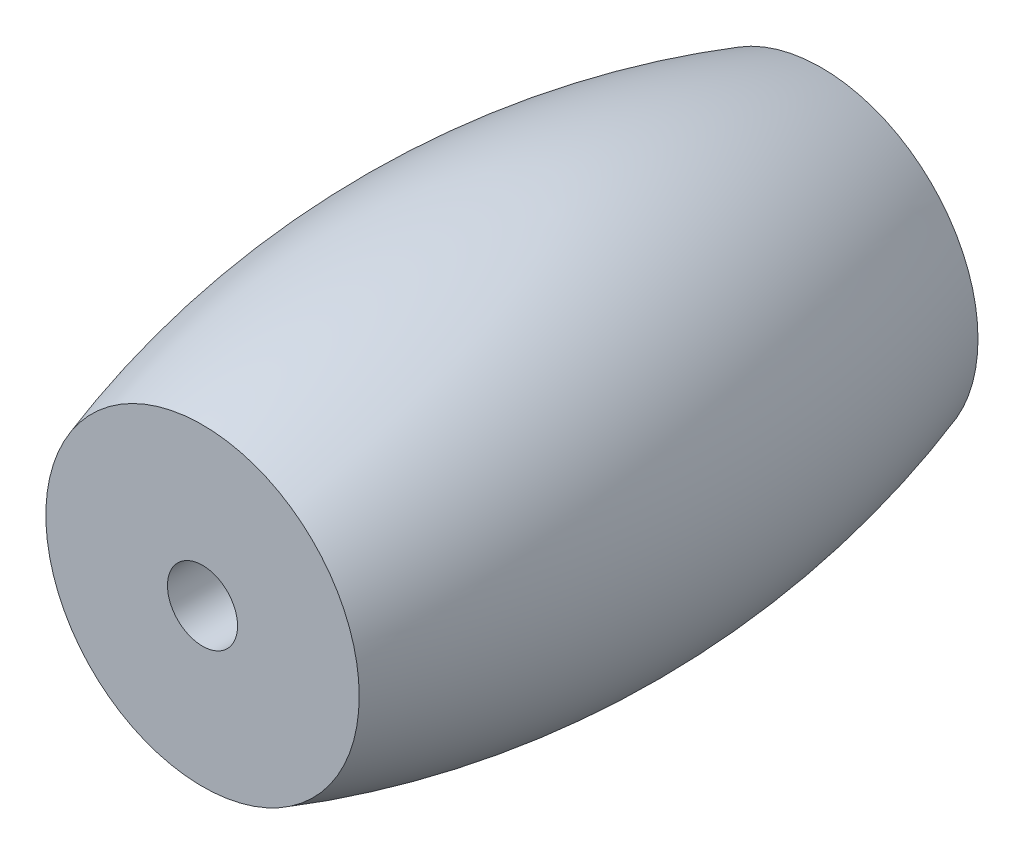
from build123d import *


with BuildPart() as part:
    # Skizze1 → Rotation3 (revolve)
    with BuildSketch(Plane(origin=(0, 0, 0), x_dir=(0, 0, -1), z_dir=(1, 0, 0)), mode=Mode.PRIVATE) as rotation3_sk:
        with BuildLine():
            ThreePointArc((15, 7.596052461), (0, 10), (-15, 7.596052461))
            Line((-15, 7.596052461), (-15, 1.7))
            Line((-15, 1.7), (15, 1.7))
            Line((15, 1.7), (15, 7.596052461))
        make_face()
    revolve(rotation3_sk.sketch.rotate(Axis((0, 0, 31.772981832), (0, 0, -1)), 90), axis=Axis((0, 0, 31.772981832), (0, 0, -1)))


solid = part.part
